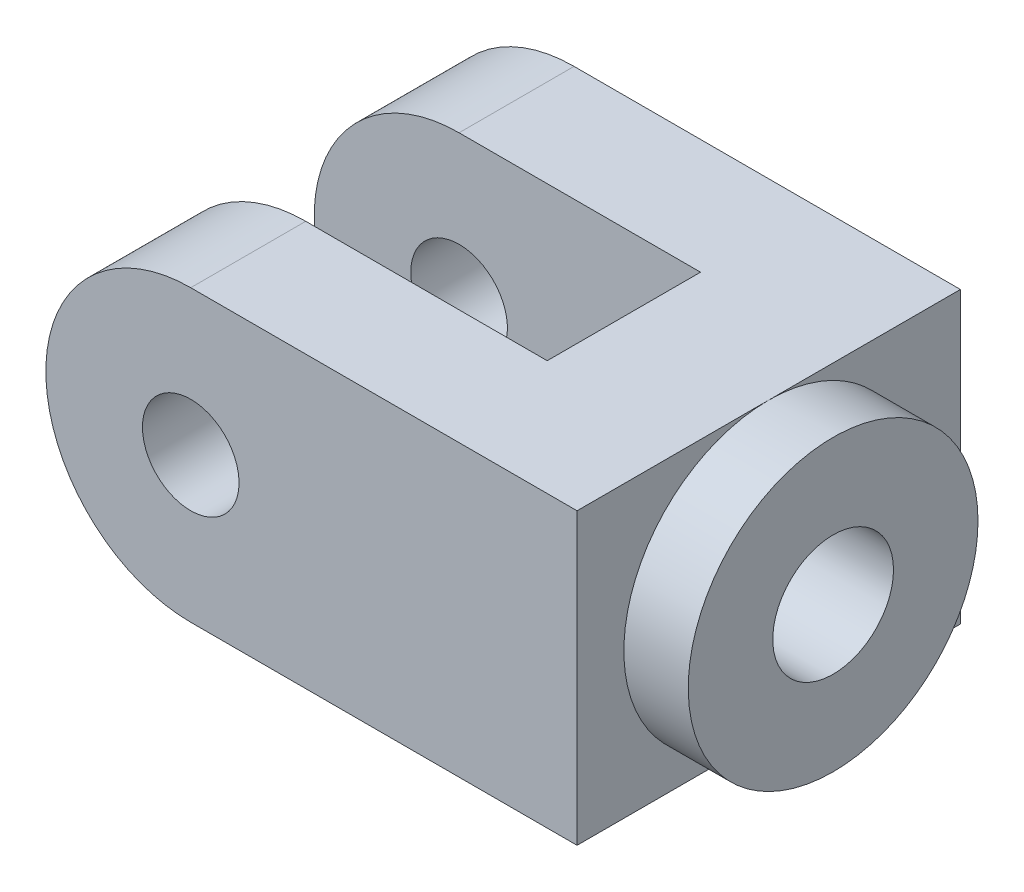
from build123d import *

# Parameters (mm, degrees)
SKETCH1_W               = 132
SKETCH1_H               = 72
BOSS_EXTRUDE1_DEPTH     = 47.625
CUT_EXTRUDE2_DEPTH      = 122.344808294
CUT_EXTRUDE2_DEPTH_BACK = 122.344808294
SKETCH3_W               = 96
SKETCH3_H               = 38.1
CUT_EXTRUDE3_DEPTH      = 109.665268715
SKETCH4_R               = 15
CUT_EXTRUDE4_DEPTH      = 145.872842952
BOSS_EXTRUDE2_START     = 16
SKETCH5_R               = 36
SKETCH5_R_2             = 15
BOSS_EXTRUDE2_DEPTH     = 16
SKETCH6_R               = 12
CUT_EXTRUDE5_DEPTH      = 131.738527221


with BuildPart() as part:
    # Sketch1 → Boss-Extrude1 (new, symmetric)
    with BuildSketch(Plane.XY):
        Rectangle(SKETCH1_W, SKETCH1_H)
    extrude(amount=BOSS_EXTRUDE1_DEPTH, both=True)

    # Sketch2 → Cut-Extrude2 (cut, two sides: drawn at the far end of the back side and taken through both)
    with BuildSketch(Plane.XY.offset(47.625).offset(-CUT_EXTRUDE2_DEPTH_BACK)):
        with BuildLine():
            Line((220.000002414, 36), (-30, 36))
            ThreePointArc((-30, 36), (-66, 7.54e-07), (-30.000001508, -36))
            Line((-30.000001508, -36), (220.000000905, -36.000010475))
            Line((220.000000905, -36.000010475), (-280.000003922, -36))
            Line((-280.000003922, -36), (-280.000002414, 36.000010475))
            Line((-280.000002414, 36.000010475), (220.000002414, 36))
        make_face()
    extrude(amount=CUT_EXTRUDE2_DEPTH + CUT_EXTRUDE2_DEPTH_BACK, mode=Mode.SUBTRACT)

    # Sketch3 → Cut-Extrude3 (cut, through all)
    with BuildSketch(Plane(origin=(0, 36, 0), x_dir=(1, 0, 0), z_dir=(0, 1, 0))):
        with Locations((-18, 0.005)):
            Rectangle(SKETCH3_W, SKETCH3_H)
    extrude(amount=-CUT_EXTRUDE3_DEPTH, mode=Mode.SUBTRACT)

    # Sketch4 → Cut-Extrude4 (cut, through all)
    with BuildSketch(Plane(origin=(66, 0, 0), x_dir=(0, 0, -1), z_dir=(1, 0, 0))):
        Circle(SKETCH4_R)
    extrude(amount=-CUT_EXTRUDE4_DEPTH, mode=Mode.SUBTRACT)

    # Sketch5 → Boss-Extrude2 (add)
    with BuildSketch(Plane(origin=(66, 0, 0), x_dir=(0, 0, -1), z_dir=(1, 0, 0)).offset(BOSS_EXTRUDE2_START)):
        with Locations(Location((0, 0, 0), (0, 0, 270))):
            Circle(SKETCH5_R)
        Circle(SKETCH5_R_2, mode=Mode.SUBTRACT)
    extrude(amount=-BOSS_EXTRUDE2_DEPTH)

    # Sketch6 → Cut-Extrude5 (cut, through all)
    with BuildSketch(Plane(origin=(0, 0, -47.625), x_dir=(-1, 0, 0), z_dir=(0, 0, -1))):
        with Locations((30, 0)):
            Circle(SKETCH6_R)
    extrude(amount=-CUT_EXTRUDE5_DEPTH, mode=Mode.SUBTRACT)


solid = part.part
